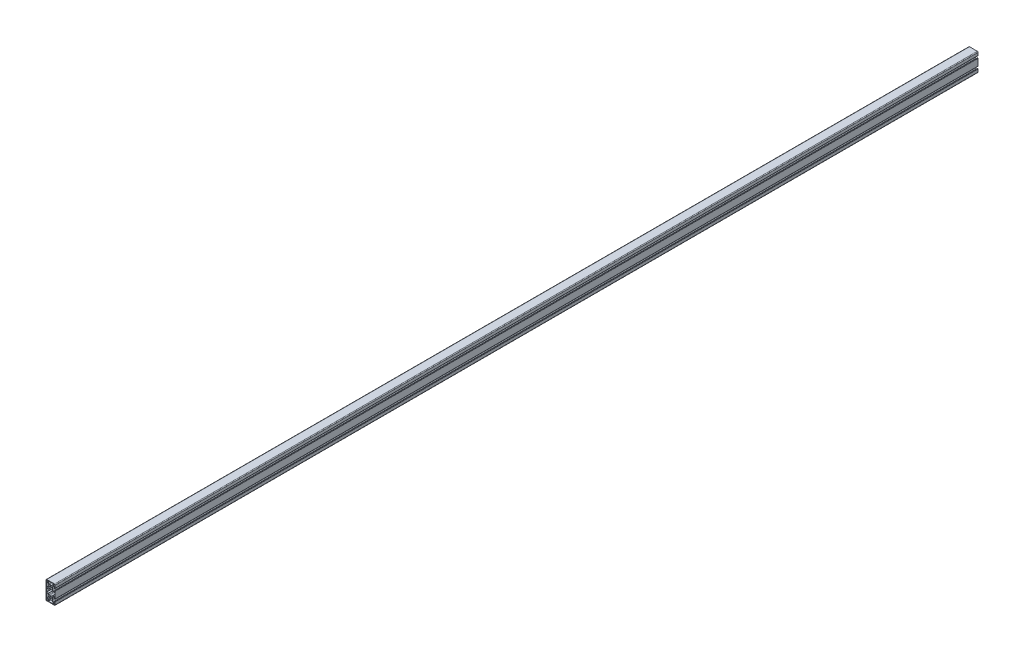
from build123d import *

# Parameters (mm, degrees)
SKETCH1_R           = 3.405
BOSS_EXTRUDE1_DEPTH = 4000


with BuildPart() as part:
    # Sketch1 → Boss-Extrude1 (new body)
    with BuildSketch(Plane(origin=(0, 0, -4000), x_dir=(-1, 0, 0), z_dir=(0, 0, -1))):
        with BuildLine():
            Line((20, -16.83), (20, 56.83))
            ThreePointArc((20, 56.83), (19.071528496, 59.071528496), (16.83, 60))
            Line((16.83, 60), (-16.83, 60))
            ThreePointArc((-16.83, 60), (-19.071528496, 59.071528496), (-20, 56.83))
            Line((-20, 56.83), (-20, 45.54033026))
            ThreePointArc((-20, 45.54033026), (-19.566421305, 44.493578695), (-18.51966974, 44.06))
            Line((-18.51966974, 44.06), (-17.80484913, 44.06))
            ThreePointArc((-17.80484913, 44.06), (-16.486201664, 44.606201664), (-15.94, 45.92484913))
            Line((-15.94, 45.92484913), (-15.94, 47.28072692))
            Line((-15.94, 47.28072692), (-16.7, 47.28072692))
            Line((-16.7, 47.28072692), (-16.7, 48.94832744))
            ThreePointArc((-16.7, 48.94832744), (-16.308497671, 49.893497671), (-15.36332744, 50.285))
            Line((-15.36332744, 50.285), (-12.987102448, 50.285))
            ThreePointArc((-12.987102448, 50.285), (-12.646514194, 50.217252784), (-12.357777413, 50.024325035))
            Line((-12.357777413, 50.024325035), (-9.091242789, 46.757790411))
            ThreePointArc((-9.091242789, 46.757790411), (-8.061572221, 45.216779505), (-7.7, 43.399033201))
            Line((-7.7, 43.399033201), (-7.7, 36.600966799))
            ThreePointArc((-7.7, 36.600966799), (-8.061572221, 34.783220495), (-9.091242789, 33.242209589))
            Line((-9.091242789, 33.242209589), (-12.357777413, 29.975674965))
            ThreePointArc((-12.357777413, 29.975674965), (-12.646514194, 29.782747216), (-12.987102448, 29.715))
            Line((-12.987102448, 29.715), (-15.36332744, 29.715))
            ThreePointArc((-15.36332744, 29.715), (-16.308497671, 30.106502329), (-16.7, 31.05167256))
            Line((-16.7, 31.05167256), (-16.7, 32.71927308))
            Line((-16.7, 32.71927308), (-15.94, 32.71927308))
            Line((-15.94, 32.71927308), (-15.94, 34.07515087))
            ThreePointArc((-15.94, 34.07515087), (-16.486201664, 35.393798336), (-17.80484913, 35.94))
            Line((-17.80484913, 35.94), (-18.51966974, 35.94))
            ThreePointArc((-18.51966974, 35.94), (-19.566421305, 35.506421305), (-20, 34.45966974))
            Line((-20, 34.45966974), (-20, 5.54033026))
            ThreePointArc((-20, 5.54033026), (-19.566421305, 4.493578695), (-18.51966974, 4.06))
            Line((-18.51966974, 4.06), (-17.80484913, 4.06))
            ThreePointArc((-17.80484913, 4.06), (-16.486201664, 4.606201664), (-15.94, 5.92484913))
            Line((-15.94, 5.92484913), (-15.94, 7.28072692))
            Line((-15.94, 7.28072692), (-16.7, 7.28072692))
            Line((-16.7, 7.28072692), (-16.7, 9.015))
            ThreePointArc((-16.7, 9.015), (-16.328025612, 9.913025612), (-15.43, 10.285))
            Line((-15.43, 10.285), (-12.987102448, 10.285))
            ThreePointArc((-12.987102448, 10.285), (-12.646514194, 10.217252784), (-12.357777413, 10.024325035))
            Line((-12.357777413, 10.024325035), (-9.091242789, 6.757790411))
            ThreePointArc((-9.091242789, 6.757790411), (-8.061572221, 5.216779505), (-7.7, 3.399033201))
            Line((-7.7, 3.399033201), (-7.7, -3.399033201))
            ThreePointArc((-7.7, -3.399033201), (-8.061572221, -5.216779505), (-9.091242789, -6.757790411))
            Line((-9.091242789, -6.757790411), (-12.357777413, -10.024325035))
            ThreePointArc((-12.357777413, -10.024325035), (-12.646514194, -10.217252784), (-12.987102448, -10.285))
            Line((-12.987102448, -10.285), (-15.36332744, -10.285))
            ThreePointArc((-15.36332744, -10.285), (-16.308497671, -9.893497671), (-16.7, -8.94832744))
            Line((-16.7, -8.94832744), (-16.7, -7.28072692))
            Line((-16.7, -7.28072692), (-15.94, -7.28072692))
            Line((-15.94, -7.28072692), (-15.94, -5.92484913))
            ThreePointArc((-15.94, -5.92484913), (-16.486201664, -4.606201664), (-17.80484913, -4.06))
            Line((-17.80484913, -4.06), (-18.51966974, -4.06))
            ThreePointArc((-18.51966974, -4.06), (-19.566421305, -4.493578695), (-20, -5.54033026))
            Line((-20, -5.54033026), (-20, -16.83))
            ThreePointArc((-20, -16.83), (-19.071528496, -19.071528496), (-16.83, -20))
            Line((-16.83, -20), (16.83, -20))
            ThreePointArc((16.83, -20), (19.071528496, -19.071528496), (20, -16.83))
        make_face()
        with Locations(Location((0, 40, 0), (0, 0, 180))):
            Circle(SKETCH1_R, mode=Mode.SUBTRACT)
        with Locations(Location((0, 0, 0), (0, 0, 180))):
            Circle(SKETCH1_R, mode=Mode.SUBTRACT)
        with BuildLine():
            Line((18.3499228, 55.5500772), (18.3499228, 52.5700772))
            ThreePointArc((18.3499228, 52.5700772), (18.165400072, 52.124599928), (17.7199228, 51.9400772))
            Line((17.7199228, 51.9400772), (13.2099228, 51.9400772))
            ThreePointArc((13.2099228, 51.9400772), (12.311897188, 52.312051588), (11.9399228, 53.2100772))
            Line((11.9399228, 53.2100772), (11.9399228, 57.7200772))
            ThreePointArc((11.9399228, 57.7200772), (12.124445528, 58.165554472), (12.5699228, 58.3500772))
            Line((12.5699228, 58.3500772), (15.5499228, 58.3500772))
            ThreePointArc((15.5499228, 58.3500772), (17.529821787, 57.529976187), (18.3499228, 55.5500772))
        make_face(mode=Mode.SUBTRACT)
        with BuildLine():
            Line((18.3499228, -12.5700772), (18.3499228, -15.5500772))
            ThreePointArc((18.3499228, -15.5500772), (17.529821787, -17.529976187), (15.5499228, -18.3500772))
            Line((15.5499228, -18.3500772), (12.5699228, -18.3500772))
            ThreePointArc((12.5699228, -18.3500772), (12.124445528, -18.165554472), (11.9399228, -17.7200772))
            Line((11.9399228, -17.7200772), (11.9399228, -13.2100772))
            ThreePointArc((11.9399228, -13.2100772), (12.311897188, -12.312051588), (13.2099228, -11.9400772))
            Line((13.2099228, -11.9400772), (17.7199228, -11.9400772))
            ThreePointArc((17.7199228, -11.9400772), (18.165400072, -12.124599928), (18.3499228, -12.5700772))
        make_face(mode=Mode.SUBTRACT)
        with BuildLine():
            Line((18.34920635, 27.17611111), (18.34920635, 12.82388889))
            ThreePointArc((18.34920635, 12.82388889), (18.088856822, 12.195349528), (17.46031746, 11.935))
            Line((17.46031746, 11.935), (9.970197693, 11.935))
            ThreePointArc((9.970197693, 11.935), (9.629609438, 11.867252784), (9.340872657, 11.674325035))
            Line((9.340872657, 11.674325035), (6.581173831, 8.914626209))
            ThreePointArc((6.581173831, 8.914626209), (5.040162925, 7.884955641), (3.222416621, 7.52338342))
            Line((3.222416621, 7.52338342), (-3.222416621, 7.52338342))
            ThreePointArc((-3.222416621, 7.52338342), (-5.040162925, 7.884955641), (-6.581173831, 8.914626209))
            Line((-6.581173831, 8.914626209), (-9.340872657, 11.674325035))
            ThreePointArc((-9.340872657, 11.674325035), (-9.629609438, 11.867252784), (-9.970197693, 11.935))
            Line((-9.970197693, 11.935), (-17.46031746, 11.935))
            ThreePointArc((-17.46031746, 11.935), (-18.088856822, 12.195349528), (-18.34920635, 12.82388889))
            Line((-18.34920635, 12.82388889), (-18.34920635, 27.17611111))
            ThreePointArc((-18.34920635, 27.17611111), (-18.088856822, 27.804650472), (-17.46031746, 28.065))
            Line((-17.46031746, 28.065), (-9.970197693, 28.065))
            ThreePointArc((-9.970197693, 28.065), (-9.629609438, 28.132747216), (-9.340872657, 28.325674965))
            Line((-9.340872657, 28.325674965), (-6.581173831, 31.085373791))
            ThreePointArc((-6.581173831, 31.085373791), (-5.040162925, 32.115044359), (-3.222416621, 32.47661658))
            Line((-3.222416621, 32.47661658), (3.222416621, 32.47661658))
            ThreePointArc((3.222416621, 32.47661658), (5.040162925, 32.115044359), (6.581173831, 31.085373791))
            Line((6.581173831, 31.085373791), (9.340872657, 28.325674965))
            ThreePointArc((9.340872657, 28.325674965), (9.629609438, 28.132747216), (9.970197693, 28.065))
            Line((9.970197693, 28.065), (17.46031746, 28.065))
            ThreePointArc((17.46031746, 28.065), (18.088856822, 27.804650472), (18.34920635, 27.17611111))
        make_face(mode=Mode.SUBTRACT)
        with BuildLine():
            Line((18.34920635, 9.39611111), (18.34920635, -9.39611111))
            ThreePointArc((18.34920635, -9.39611111), (18.088856822, -10.024650472), (17.46031746, -10.285))
            Line((17.46031746, -10.285), (12.987102448, -10.285))
            ThreePointArc((12.987102448, -10.285), (12.646514194, -10.217252784), (12.357777413, -10.024325035))
            Line((12.357777413, -10.024325035), (9.091242789, -6.757790411))
            ThreePointArc((9.091242789, -6.757790411), (8.061572221, -5.216779505), (7.7, -3.399033201))
            Line((7.7, -3.399033201), (7.7, 3.399033201))
            ThreePointArc((7.7, 3.399033201), (8.061572221, 5.216779505), (9.091242789, 6.757790411))
            Line((9.091242789, 6.757790411), (12.357777413, 10.024325035))
            ThreePointArc((12.357777413, 10.024325035), (12.646514194, 10.217252784), (12.987102448, 10.285))
            Line((12.987102448, 10.285), (17.46031746, 10.285))
            ThreePointArc((17.46031746, 10.285), (18.088856822, 10.024650472), (18.34920635, 9.39611111))
        make_face(mode=Mode.SUBTRACT)
        with BuildLine():
            Line((18.34920635, 49.39611111), (18.34920635, 30.60388889))
            ThreePointArc((18.34920635, 30.60388889), (18.088856822, 29.975349528), (17.46031746, 29.715))
            Line((17.46031746, 29.715), (12.987102448, 29.715))
            ThreePointArc((12.987102448, 29.715), (12.646514194, 29.782747216), (12.357777413, 29.975674965))
            Line((12.357777413, 29.975674965), (9.091242789, 33.242209589))
            ThreePointArc((9.091242789, 33.242209589), (8.061572221, 34.783220495), (7.7, 36.600966799))
            Line((7.7, 36.600966799), (7.7, 43.399033201))
            ThreePointArc((7.7, 43.399033201), (8.061572221, 45.216779505), (9.091242789, 46.757790411))
            Line((9.091242789, 46.757790411), (12.357777413, 50.024325035))
            ThreePointArc((12.357777413, 50.024325035), (12.646514194, 50.217252784), (12.987102448, 50.285))
            Line((12.987102448, 50.285), (17.46031746, 50.285))
            ThreePointArc((17.46031746, 50.285), (18.088856822, 50.024650472), (18.34920635, 49.39611111))
        make_face(mode=Mode.SUBTRACT)
        with BuildLine():
            Line((10.2899228, 57.46118831), (10.2899228, 52.992025248))
            ThreePointArc((10.2899228, 52.992025248), (10.222175584, 52.651436994), (10.029247835, 52.362700213))
            Line((10.029247835, 52.362700213), (6.581173831, 48.914626209))
            ThreePointArc((6.581173831, 48.914626209), (5.040162925, 47.884955641), (3.222416621, 47.52338342))
            Line((3.222416621, 47.52338342), (-3.222416621, 47.52338342))
            ThreePointArc((-3.222416621, 47.52338342), (-5.040162925, 47.884955641), (-6.581173831, 48.914626209))
            Line((-6.581173831, 48.914626209), (-10.029247835, 52.362700213))
            ThreePointArc((-10.029247835, 52.362700213), (-10.222175584, 52.651436994), (-10.2899228, 52.992025248))
            Line((-10.2899228, 52.992025248), (-10.2899228, 57.46118831))
            ThreePointArc((-10.2899228, 57.46118831), (-10.029573272, 58.089727672), (-9.40103391, 58.3500772))
            Line((-9.40103391, 58.3500772), (9.40103391, 58.3500772))
            ThreePointArc((9.40103391, 58.3500772), (10.029573272, 58.089727672), (10.2899228, 57.46118831))
        make_face(mode=Mode.SUBTRACT)
        with BuildLine():
            Line((10.2899228, -12.992025248), (10.2899228, -17.42161897))
            ThreePointArc((10.2899228, -17.42161897), (10.029573272, -18.050158332), (9.40103391, -18.31050786))
            Line((9.40103391, -18.31050786), (-9.40103391, -18.31050786))
            ThreePointArc((-9.40103391, -18.31050786), (-10.029573272, -18.050158332), (-10.2899228, -17.42161897))
            Line((-10.2899228, -17.42161897), (-10.2899228, -12.992025248))
            ThreePointArc((-10.2899228, -12.992025248), (-10.222175584, -12.651436994), (-10.029247835, -12.362700213))
            Line((-10.029247835, -12.362700213), (-6.581173831, -8.914626209))
            ThreePointArc((-6.581173831, -8.914626209), (-5.040162925, -7.884955641), (-3.222416621, -7.52338342))
            Line((-3.222416621, -7.52338342), (3.222416621, -7.52338342))
            ThreePointArc((3.222416621, -7.52338342), (5.040162925, -7.884955641), (6.581173831, -8.914626209))
            Line((6.581173831, -8.914626209), (10.029247835, -12.362700213))
            ThreePointArc((10.029247835, -12.362700213), (10.222175584, -12.651436994), (10.2899228, -12.992025248))
        make_face(mode=Mode.SUBTRACT)
        with BuildLine():
            Line((-11.9399228, 57.7200772), (-11.9399228, 53.2100772))
            ThreePointArc((-11.9399228, 53.2100772), (-12.311897188, 52.312051588), (-13.2099228, 51.9400772))
            Line((-13.2099228, 51.9400772), (-17.7199228, 51.9400772))
            ThreePointArc((-17.7199228, 51.9400772), (-18.165400072, 52.124599928), (-18.3499228, 52.5700772))
            Line((-18.3499228, 52.5700772), (-18.3499228, 55.5500772))
            ThreePointArc((-18.3499228, 55.5500772), (-17.529821787, 57.529976187), (-15.5499228, 58.3500772))
            Line((-15.5499228, 58.3500772), (-12.5699228, 58.3500772))
            ThreePointArc((-12.5699228, 58.3500772), (-12.124445528, 58.165554472), (-11.9399228, 57.7200772))
        make_face(mode=Mode.SUBTRACT)
        with BuildLine():
            Line((-11.9399228, -13.2100772), (-11.9399228, -17.7200772))
            ThreePointArc((-11.9399228, -17.7200772), (-12.124445528, -18.165554472), (-12.5699228, -18.3500772))
            Line((-12.5699228, -18.3500772), (-15.5499228, -18.3500772))
            ThreePointArc((-15.5499228, -18.3500772), (-17.529821787, -17.529976187), (-18.3499228, -15.5500772))
            Line((-18.3499228, -15.5500772), (-18.3499228, -12.5700772))
            ThreePointArc((-18.3499228, -12.5700772), (-18.165400072, -12.124599928), (-17.7199228, -11.9400772))
            Line((-17.7199228, -11.9400772), (-13.2099228, -11.9400772))
            ThreePointArc((-13.2099228, -11.9400772), (-12.311897188, -12.312051588), (-11.9399228, -13.2100772))
        make_face(mode=Mode.SUBTRACT)
    extrude(amount=-BOSS_EXTRUDE1_DEPTH)


solid = part.part
